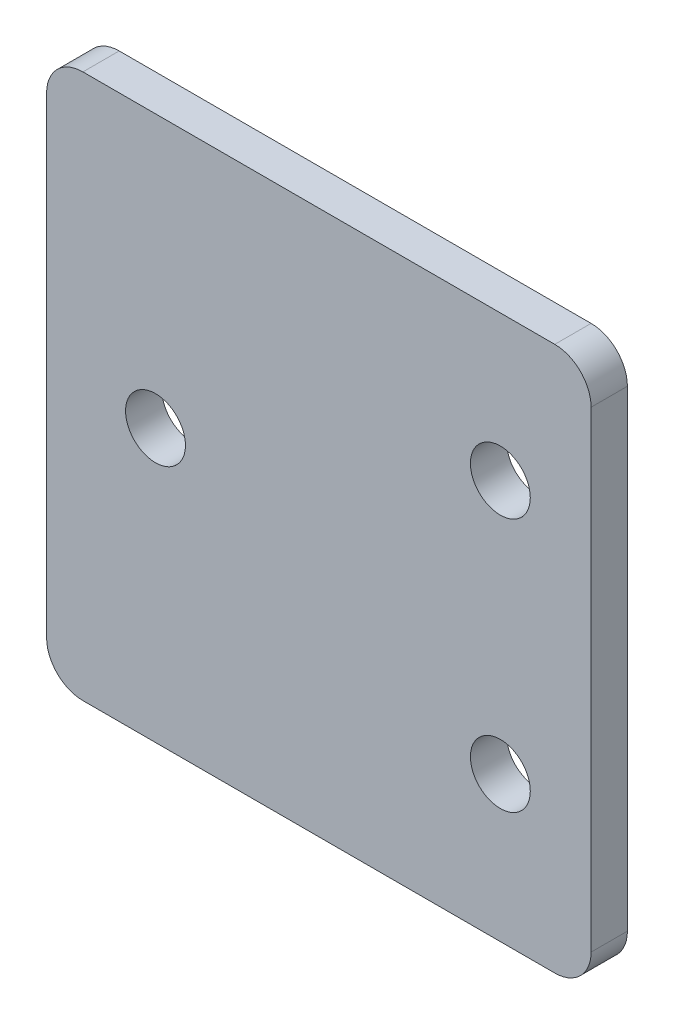
from build123d import *

# Parameters (mm, degrees)
SKETCH1_W             = 30
SKETCH1_H             = 30
BOSS_EXTRUDE1_DEPTH   = 2
FILLET1_R             = 2
F_3_0MM_DOWEL_HOLE1_D = 3.3


with BuildPart() as part:
    # Sketch1 → Boss-Extrude1 (new body)
    with BuildSketch(Plane.XY):
        Rectangle(SKETCH1_W, SKETCH1_H)
    extrude(amount=BOSS_EXTRUDE1_DEPTH)

    # Fillet1
    fillet1_edges = [part.edges().sort_by_distance(p)[0] for p in [
        (15, -15, 1),
        (-15, -15, 1),
        (-15, 15, 1),
        (15, 15, 1),
    ]]
    fillet(fillet1_edges, radius=FILLET1_R)

    # Ø3.0mm Dowel Hole1 (through all)
    with Locations(Plane(origin=(-9, 0, 2), x_dir=(1, 0, 0), z_dir=(0, 0, 1))):
        with Locations((0, 0), (19, 7), (19, -7)):
            Hole(F_3_0MM_DOWEL_HOLE1_D / 2)


solid = part.part
